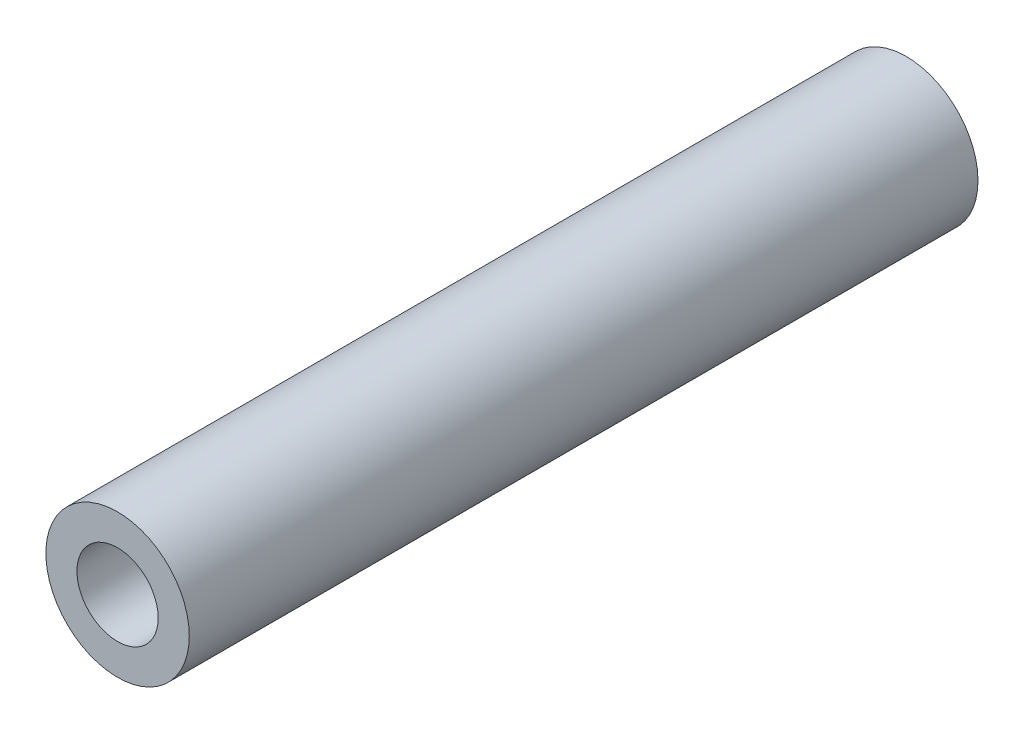
from build123d import *

# Parameters (mm, degrees)
SKETCH1_R           = 3
SKETCH1_R_2         = 1.7
RING_ENVELOPE_DEPTH = 33


with BuildPart() as part:
    # Sketch1 → Ring_Envelope (new body)
    with BuildSketch(Plane.XY):
        Circle(SKETCH1_R)
        Circle(SKETCH1_R_2, mode=Mode.SUBTRACT)
    extrude(amount=RING_ENVELOPE_DEPTH)


solid = part.part
